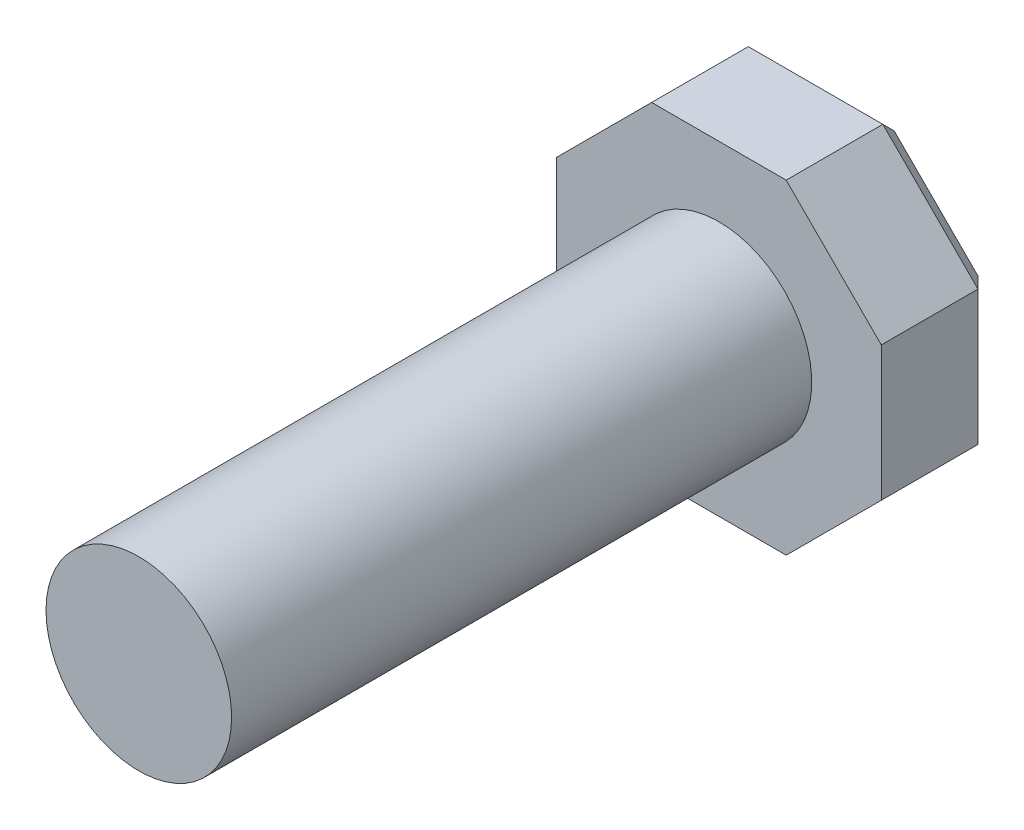
from build123d import *

# Parameters (mm, degrees)
EXTRUDE2_DEPTH = 15
CHAMFER3_SIZE  = 2.5
SKETCH3_R      = 12
EXTRUDE3_DEPTH = 75


with BuildPart() as part:
    # Sketch2 → Extrude2 (new body)
    with BuildSketch(Plane.XY):
        Polygon((-21, 8.69848481), (-8.69848481, 21), (8.69848481, 21), (21, 8.69848481), (21, -8.69848481), (8.69848481, -21), (-8.69848481, -21), (-21, -8.69848481), align=None)
    extrude(amount=EXTRUDE2_DEPTH)

    # Chamfer3
    chamfer3_edges = [part.edges().sort_by_distance(p)[0] for p in [
        (14.849242405, 14.849242405, 0),
        (21, 0, 0),
        (14.849242405, -14.849242405, 0),
        (0, -21, 0),
        (-14.849242405, -14.849242405, 0),
        (-21, 0, 0),
        (-14.849242405, 14.849242405, 0),
        (0, 21, 0),
    ]]
    chamfer(chamfer3_edges, length=CHAMFER3_SIZE)

    # Sketch3 → Extrude3 (add)
    with BuildSketch(Plane.XY.offset(15)):
        with Locations(Location((0, 0, 0), (0, 0, 180))):
            Circle(SKETCH3_R)
    extrude(amount=EXTRUDE3_DEPTH)


solid = part.part
